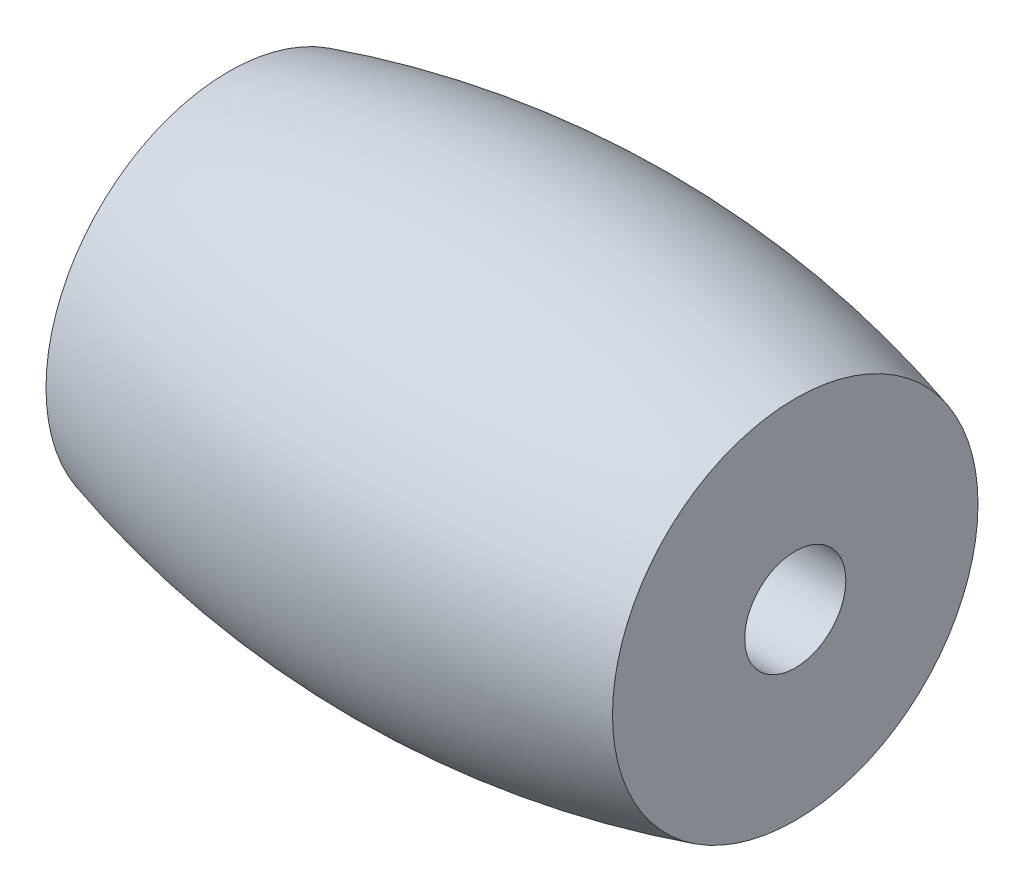
from build123d import *

# Parameters (mm, degrees)
SKETCH_2_R          = 1.25
CUT_EXTRUDE_1_DEPTH = 18


with BuildPart() as part:
    # 草图1 → 旋转1 (revolve)
    with BuildSketch(Plane.XY, mode=Mode.PRIVATE) as revolve_1_sk:
        with BuildLine():
            Line((7, 19.9), (-7, 19.9))
            Line((-7, 19.9), (-7, 15.383612061))
            ThreePointArc((-7, 15.383612061), (0, 14.4), (7, 15.383612061))
            Line((7, 15.383612061), (7, 19.9))
        make_face()
    revolve(revolve_1_sk.sketch.rotate(Axis((7, 19.9, 0), (-1, 0, 0)), 270), axis=Axis((7, 19.9, 0), (-1, 0, 0)))

    # 草图2 → 切除-拉伸1 (cut)
    with BuildSketch(Plane(origin=(7, 0, 0), x_dir=(0, 0, -1), z_dir=(1, 0, 0))):
        with Locations((0, 19.9)):
            Circle(SKETCH_2_R)
    extrude(amount=-CUT_EXTRUDE_1_DEPTH, mode=Mode.SUBTRACT)


solid = part.part
